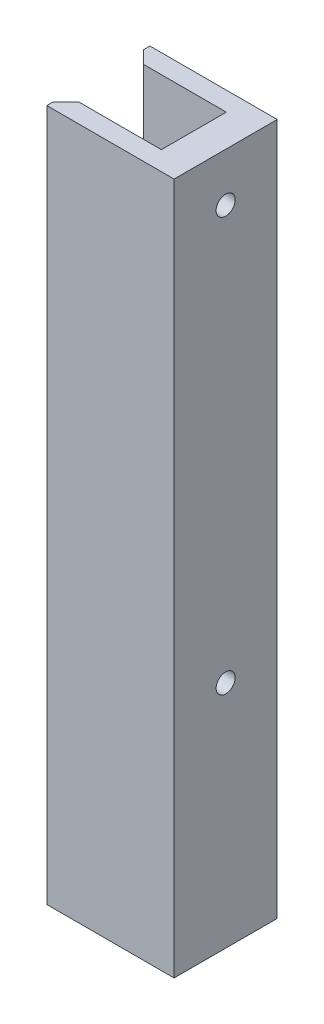
from build123d import *

# Parameters (mm, degrees)
SKETCH_1_W      = 10
SKETCH_1_H      = 105.5
SKETCH_1_R      = 1.6
SKETCH_1_H_2    = 0.1
SKETCH_1_R_2    = 1.5
EXTRUDE_1_DEPTH = 5
EXTRUDE_2_DEPTH = 105.7
CHAMFER_1_SIZE  = 2
EXTRUDE_3_DEPTH = 3


with BuildPart() as part:
    # ｽｹｯﾁ1 → ﾎﾞｽ - 押し出し1 (new body)
    # profile 1 of 5: a face of its own
    with BuildSketch(Plane(origin=(-2.03481113, 0, 0), x_dir=(0, 0, -1), z_dir=(1, 0, 0))):
        with Locations((-131, -7.323272389)):
            Rectangle(SKETCH_1_W, SKETCH_1_H)
        with Locations((-131, -27.073272389)):
            Circle(SKETCH_1_R, mode=Mode.SUBTRACT)
        with Locations((-131, 37.926727611)):
            Circle(SKETCH_1_R, mode=Mode.SUBTRACT)
    # profile 2 of 5: a face of its own
    with BuildSketch(Plane(origin=(-2.03481113, 0, 0), x_dir=(0, 0, -1), z_dir=(1, 0, 0))):
        Polygon((-136, -60.073272389), (-136, 45.426727611), (-136, 45.526727611), (-136.1, 45.526727611), (-136.1, -60.173272389), (-125.9, -60.173272389), (-125.9, 45.526727611), (-126, 45.526727611), (-126, 45.426727611), (-126, -60.073272389), align=None)
    # profile 3 of 5: a face of its own
    with BuildSketch(Plane(origin=(-2.03481113, 0, 0), x_dir=(0, 0, -1), z_dir=(1, 0, 0))):
        with Locations((-131, 45.476727611)):
            Rectangle(SKETCH_1_W, SKETCH_1_H_2)
    # profile 4 of 5: a face of its own
    with BuildSketch(Plane(origin=(-2.03481113, 0, 0), x_dir=(0, 0, -1), z_dir=(1, 0, 0))):
        with Locations((-131, 37.926727611)):
            Circle(SKETCH_1_R)
        with Locations((-131, 37.926727611)):
            Circle(SKETCH_1_R_2, mode=Mode.SUBTRACT)
    # profile 5 of 5: a face of its own
    with BuildSketch(Plane(origin=(-2.03481113, 0, 0), x_dir=(0, 0, -1), z_dir=(1, 0, 0))):
        with Locations((-131, -27.073272389)):
            Circle(SKETCH_1_R)
        with Locations((-131, -27.073272389)):
            Circle(SKETCH_1_R_2, mode=Mode.SUBTRACT)
    extrude(amount=EXTRUDE_1_DEPTH)

    # ｽｹｯﾁ2 → ﾎﾞｽ - 押し出し2 (add)
    with BuildSketch(Plane.XZ.offset(60.173272389)):
        Polygon((2.96518887, 139.1), (-17.03481113, 139.1), (-17.03481113, 136.1), (-2.03481113, 136.1), (2.96518887, 136.1), align=None)
        Polygon((2.96518887, 122.9), (2.96518887, 125.9), (-2.03481113, 125.9), (-17.03481113, 125.9), (-17.03481113, 122.9), align=None)
    extrude(amount=-EXTRUDE_2_DEPTH)

    # 面取り1
    chamfer_1_edges = [part.edges().sort_by_distance(p)[0] for p in [
        (-17.03481113, -7.323272389, 136.1),
        (-17.03481113, -7.323272389, 125.9),
    ]]
    chamfer(chamfer_1_edges, length=CHAMFER_1_SIZE)

    # ｽｹｯﾁ3 → ﾎﾞｽ - 押し出し3 (add)
    with BuildSketch(Plane.XZ.offset(60.173272389)):
        Polygon((-2.03481113, 136.1), (-2.03481113, 125.9), (-15.03481113, 125.9), (-17.03481113, 123.9), (-17.03481113, 122.9), (2.96518887, 122.9), (2.96518887, 139.1), (-17.03481113, 139.1), (-17.03481113, 138.1), (-15.03481113, 136.1), align=None)
        Polygon((-15.03481113, 136.1), (-17.03481113, 138.1), (-17.03481113, 123.9), (-15.03481113, 125.9), (-2.03481113, 125.9), (-2.03481113, 136.1), align=None)
    extrude(amount=EXTRUDE_3_DEPTH)


solid = part.part
